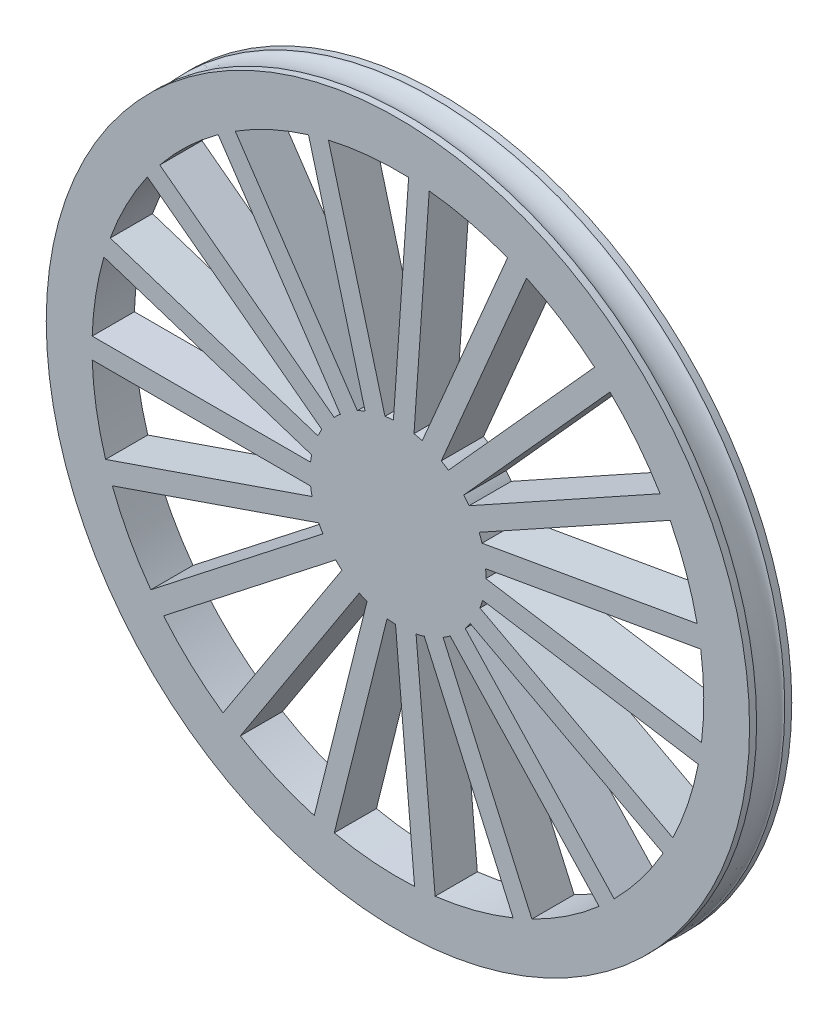
from build123d import *

# Parameters (mm, degrees)
BOSS_EXTRUDE1_DEPTH      = 15
BOSS_EXTRUDE1_DEPTH_BACK = 15
BOSS_EXTRUDE2_DEPTH      = 30
CIRPATTERN1_COUNT        = 19
CIRPATTERN1_ANGLE        = 342


with BuildPart() as part:
    # Sketch2 → Boss-Extrude1 (new, two sides: drawn at the far end of the back side and taken through both)
    with BuildSketch(Plane.XY.offset(-BOSS_EXTRUDE1_DEPTH_BACK)):
        with BuildLine():
            ThreePointArc((0, 32.558207974), (-217.441792026, 250), (0, 467.441792026))
            Line((0, 467.441792026), (0, 500))
            ThreePointArc((0, 500), (-250, 250), (0, 0))
            Line((0, 0), (0, 32.558207974))
        make_face()
        with BuildLine():
            Line((0, 500), (0, 467.441792026))
            ThreePointArc((0, 467.441792026), (153.754565655, 403.754565655), (217.441792026, 250))
            ThreePointArc((217.441792026, 250), (153.754565655, 96.245434345), (0, 32.558207974))
            Line((0, 32.558207974), (0, 0))
            ThreePointArc((0, 0), (176.776695297, 73.223304703), (250, 250))
            ThreePointArc((250, 250), (176.776695297, 426.776695297), (0, 500))
        make_face()
        with BuildLine():
            Line((0, 312.5), (0, 260))
            Line((0, 260), (0, 240))
            Line((0, 240), (0, 187.5))
            ThreePointArc((0, 187.5), (44.194173824, 205.805826176), (62.5, 250))
            ThreePointArc((62.5, 250), (44.194173824, 294.194173824), (0, 312.5))
        make_face()
        with BuildLine():
            Line((0, 240), (0, 260))
            Line((0, 260), (0, 312.5))
            ThreePointArc((0, 312.5), (-62.5, 250), (0, 187.5))
            Line((0, 187.5), (0, 240))
        make_face()
    extrude(amount=BOSS_EXTRUDE1_DEPTH + BOSS_EXTRUDE1_DEPTH_BACK)

    # Sketch4 → Boss-Extrude2 (add)
    with BuildSketch(Plane.XY.offset(15)):
        with BuildLine():
            ThreePointArc((-62.043119193, 242.456700933), (-62.499642772, 249.788686637), (-62.092708437, 257.123591721))
            Line((-62.092708437, 257.123591721), (-217.325073014, 257.123591721))
            add(Edge.make_bspline(
                [(-217.325073014, 257.123591721), (-218.805807348, 249.792999154), (-217.310909893, 242.456700933)],
                knots=[0, 0, 0, 1, 1, 1], degree=2))
            Line((-217.310909893, 242.456700933), (-62.043119193, 242.456700933))
        make_face()
    boss_extrude2 = extrude(amount=-BOSS_EXTRUDE2_DEPTH)

    # CirPattern1: Boss-Extrude2 ×19 about axis
    cirpattern1_axis = Axis((0, 250, 0), (0, 0, 1))
    for i in range(1, CIRPATTERN1_COUNT):
        add(boss_extrude2.rotate(cirpattern1_axis, i * CIRPATTERN1_ANGLE / (CIRPATTERN1_COUNT - 1)))

    # Sketch1 → Cut-Revolve1 (revolve, cut)
    with BuildSketch(Plane(origin=(0, 0, 0), x_dir=(0, 0, -1), z_dir=(1, 0, 0)), mode=Mode.PRIVATE) as cut_revolve1_sk:
        with BuildLine():
            Line((-10, 0), (-10, -1.402735917))
            Line((-10, -1.402735917), (10, -1.402735917))
            Line((10, -1.402735917), (10, 0))
            add(Edge.make_bspline(
                [(10, 0), (10, 3), (0, 3), (-10, 3), (-10, 0)],
                knots=[0, 0, 0, 1.570796327, 1.570796327, 3.141592654, 3.141592654, 3.141592654], degree=2, weights=[1, 0.707106781, 1, 0.707106781, 1]))
        make_face()
    revolve(cut_revolve1_sk.sketch.rotate(Axis((0, 250, 0), (0, 0, 1)), 270), axis=Axis((0, 250, 0), (0, 0, 1)), mode=Mode.SUBTRACT)


solid = part.part
